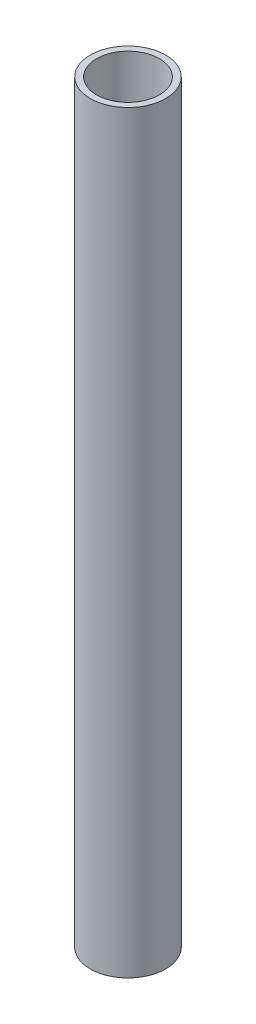
from build123d import *

# Parameters (mm, degrees)
SKETCH_1_R      = 6
SKETCH_1_R_2    = 5
EXTRUDE_1_DEPTH = 50
SKETCH_3_R      = 6
SKETCH_3_R_2    = 5
EXTRUDE_2_DEPTH = 70


with BuildPart() as part:
    # 草图1 → 凸台-拉伸1 (new body)
    with BuildSketch(Plane(origin=(0, 0, 0), x_dir=(1, 0, 0), z_dir=(0, 1, 0))):
        with Locations(Location((0, 0, 0), (0, 0, 270))):
            Circle(SKETCH_1_R)
        with Locations(Location((0, 0, 0), (0, 0, 270))):
            Circle(SKETCH_1_R_2, mode=Mode.SUBTRACT)
    extrude(amount=EXTRUDE_1_DEPTH)

    # 草图3 → 凸台-拉伸2 (add)
    with BuildSketch(Plane(origin=(0, 50, 0), x_dir=(1, 0, 0), z_dir=(0, 1, 0))):
        with Locations(Location((0, 0, 0), (0, 0, 270))):
            Circle(SKETCH_3_R)
        with Locations(Location((0, 0, 0), (0, 0, 270))):
            Circle(SKETCH_3_R_2, mode=Mode.SUBTRACT)
    extrude(amount=EXTRUDE_2_DEPTH)


solid = part.part
